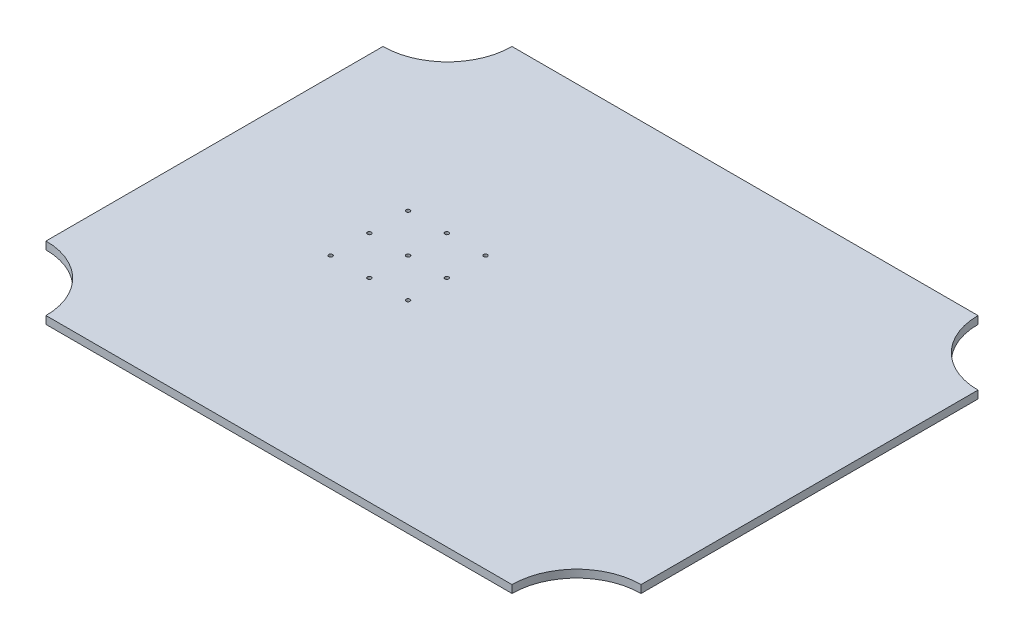
from build123d import *

# Parameters (mm, degrees)
SKETCH_1_R      = 1.5
EXTRUDE_1_DEPTH = 6


with BuildPart() as part:
    # 草图1 → 凸台-拉伸1 (new body)
    with BuildSketch(Plane(origin=(0, 0, 0), x_dir=(1, 0, 0), z_dir=(0, 1, 0))):
        with BuildLine():
            Line((-100, 180.5), (261, 180.5))
            ThreePointArc((261, 180.5), (275.644660941, 145.144660941), (311, 130.5))
            Line((311, 130.5), (311, -130.5))
            ThreePointArc((311, -130.5), (275.644660941, -145.144660941), (261, -180.5))
            Line((261, -180.5), (-100, -180.5))
            ThreePointArc((-100, -180.5), (-114.644660941, -145.144660941), (-150, -130.5))
            Line((-150, -130.5), (-150, 130.5))
            ThreePointArc((-150, 130.5), (-114.644660941, 145.144660941), (-100, 180.5))
        make_face()
        with Locations(Location((-30, 0, 0), (0, 0, 270))):
            Circle(SKETCH_1_R, mode=Mode.SUBTRACT)
        with Locations(Location((-30, 30, 0), (0, 0, 270))):
            Circle(SKETCH_1_R, mode=Mode.SUBTRACT)
        with Locations(Location((0, 30, 0), (0, 0, 270))):
            Circle(SKETCH_1_R, mode=Mode.SUBTRACT)
        with Locations(Location((30, 30, 0), (0, 0, 270))):
            Circle(SKETCH_1_R, mode=Mode.SUBTRACT)
        with Locations(Location((0, 0, 0), (0, 0, 270))):
            Circle(SKETCH_1_R, mode=Mode.SUBTRACT)
        with Locations(Location((30, 0, 0), (0, 0, 270))):
            Circle(SKETCH_1_R, mode=Mode.SUBTRACT)
        with Locations(Location((30, -30, 0), (0, 0, 90))):
            Circle(SKETCH_1_R, mode=Mode.SUBTRACT)
        with Locations(Location((0, -30, 0), (0, 0, 90))):
            Circle(SKETCH_1_R, mode=Mode.SUBTRACT)
        with Locations(Location((-30, -30, 0), (0, 0, 90))):
            Circle(SKETCH_1_R, mode=Mode.SUBTRACT)
    extrude(amount=EXTRUDE_1_DEPTH)


solid = part.part
